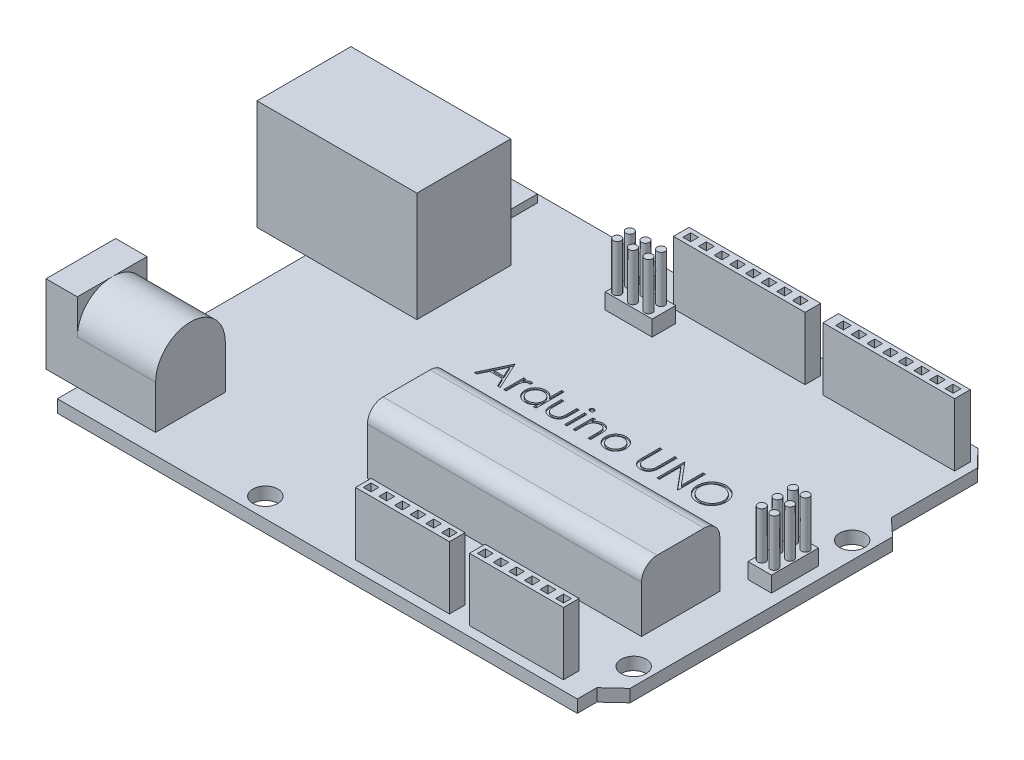
from build123d import *

# Parameters (mm, degrees)
ESQUISSE1_R              = 1.6
PLAQUE_DEPTH             = 1.6
ESQUISSE3_W              = 20.405520634
ESQUISSE3_H              = 12
USB_DEPTH                = 14
ESQUISSE6_W              = 0.314102564
ESQUISSE6_H              = 2.557692307
ARDUINO_UNO_DEPTH        = 0.2
ESQUISSE7_W              = 12
ESQUISSE7_H              = 2
ESQUISSE7_W_2            = 1
ESQUISSE7_H_2            = 1
ESQUISSE7_W_3            = 16.81537658
PIN_1_DEPTH              = 8
USB_VIDE_DEPTH           = 10
ESQUISSE10_W             = 14
ESQUISSE10_H             = 8.9
VOLT_BASE_DEPTH          = 10
VOLT_VIDE_1_DEPTH        = 10
ESQUISSE12_R             = 3.45
VOLT_VIDE_2_DEPTH        = 10
ESQUISSE13_W             = 35
ESQUISSE13_H             = 10
MICROCONTROLLEUR_DEPTH   = 8
MICROCONTROLLEUR_CONGE_R = 2
ESQUISSE14_W             = 3
ESQUISSE14_H             = 6
ESQUISSE14_W_2           = 6
ESQUISSE14_H_2           = 3
PIN_BASE_DEPTH           = 2
ESQUISSE15_R             = 0.5
PIN_PIC_1_DEPTH          = 6
ESQUISSE16_R             = 0.5
PIN_PIC_2_DEPTH          = 6
ESQUISSE17_W             = 6
ESQUISSE17_H             = 6
RESET_BASE_DEPTH         = 1
ESQUISSE18_R             = 1.5
RESET_BOUTON_DEPTH       = 1


with BuildPart() as part:
    # Esquisse1 → PLAQUE (new body)
    with BuildSketch(Plane(origin=(0, 0, 0), x_dir=(1, 0, 0), z_dir=(0, 1, 0))):
        Polygon((32.1, 24.602081959), (29.973807226, 26.823263494), (-34.3, 26.823263494), (-34.3, -26.476736506), (32.1, -26.476736506), (32.1, -23.976736506), (34.3, -21.9371287), (34.3, 11.58568027), (32.1, 13.625288075), align=None)
        with Locations(Location((-10.238193611, -23.976736506, 0), (0, 0, 270))):
            Circle(ESQUISSE1_R, mode=Mode.SUBTRACT)
        with Locations(Location((32.1, -19.276736506, 0), (0, 0, 270))):
            Circle(ESQUISSE1_R, mode=Mode.SUBTRACT)
        with Locations(Location((-9.138193611, 23.823263494, 0), (0, 0, 270))):
            Circle(ESQUISSE1_R, mode=Mode.SUBTRACT)
        with Locations(Location((32.1, 8.623263494, 0), (0, 0, 270))):
            Circle(ESQUISSE1_R, mode=Mode.SUBTRACT)
    extrude(amount=PLAQUE_DEPTH)

    # Esquisse3 → USB (add)
    with BuildSketch(Plane(origin=(0, 1.6, 0), x_dir=(1, 0, 0), z_dir=(0, 1, 0))):
        with Locations((-30.297239683, 11.223263494)):
            Rectangle(ESQUISSE3_W, ESQUISSE3_H)
    extrude(amount=USB_DEPTH)

    # Esquisse6 → Arduino UNO (cut)
    # profile 1 of 11: a face of its own
    with BuildSketch(Plane(origin=(0, 1.6, 0), x_dir=(1, 0, 0), z_dir=(0, 1, 0))):
        Polygon((-8.889191313, 6.549549438), (-7.273806697, 3.049549438), (-7.615253012, 3.049549438), (-8.132680896, 4.171344309), (-9.719319518, 4.171344309), (-10.25147096, 3.049549438), (-10.594319518, 3.049549438), (-8.934063108, 6.549549438), align=None)
        Polygon((-8.915132819, 5.867357931), (-9.548946922, 4.530318668), (-8.29814564, 4.530318668), align=None, mode=Mode.SUBTRACT)
    # profile 2 of 11: a face of its own
    with BuildSketch(Plane(origin=(0, 1.6, 0), x_dir=(1, 0, 0), z_dir=(0, 1, 0))):
        with BuildLine():
            Line((-6.825088749, 5.607241745), (-6.510986185, 5.607241745))
            Line((-6.510986185, 5.607241745), (-6.510986185, 5.230739341))
            add(Edge.make_bspline(
                [(-6.510986185, 5.230739341), (-6.487797426, 5.26579517), (-6.443449105, 5.332839169), (-6.369736176, 5.42150847), (-6.294232844, 5.494923517), (-6.216577657, 5.553427035), (-6.136199557, 5.597240154), (-6.054862605, 5.629333189), (-5.971287135, 5.648310505), (-5.915125211, 5.650844164), (-5.886987787, 5.65211354)],
                knots=[0, 0, 0, 0, 1.2804753, 2.448899062, 3.506932113, 4.484331642, 5.4025378, 6.288909075, 7.142734305, 8, 8, 8, 8], degree=3))
            add(Edge.make_bspline(
                [(-5.886987787, 5.65211354), (-5.865161461, 5.650923014), (-5.820252375, 5.648473428), (-5.752269786, 5.631262603), (-5.682226334, 5.603784581), (-5.637083946, 5.577944358), (-5.613550287, 5.564473316)],
                knots=[0, 0, 0, 0, 0.901110191, 1.854092781, 2.881294221, 4, 4, 4, 4], degree=3))
            Line((-5.613550287, 5.564473316), (-5.786026249, 5.292438059))
            add(Edge.make_bspline(
                [(-5.786026249, 5.292438059), (-5.80113527, 5.299178326), (-5.829815084, 5.311972641), (-5.871769651, 5.327114651), (-5.910450987, 5.336030567), (-5.935094546, 5.337381284), (-5.94658314, 5.338010976)],
                knots=[0, 0, 0, 0, 1.180555205, 2.24091978, 3.179933427, 4, 4, 4, 4], degree=3))
            add(Edge.make_bspline(
                [(-5.94658314, 5.338010976), (-5.971788873, 5.336330939), (-6.023201263, 5.332904149), (-6.098685763, 5.305965342), (-6.171932968, 5.262440102), (-6.23010463, 5.21416899), (-6.275146883, 5.167621192), (-6.307287109, 5.12697279), (-6.336769856, 5.081394158), (-6.364940076, 5.031664474), (-6.39060637, 4.976934628), (-6.41456104, 4.917751415), (-6.436219903, 4.854046286), (-6.448570147, 4.809663766), (-6.454896441, 4.786929245)],
                knots=[0, 0, 0, 0, 1.125678352, 2.296057538, 3.5422874, 4.923748041, 5.663163013, 6.437101912, 7.23742474, 8.08941207, 8.991984279, 9.93940061, 10.944477711, 12, 12, 12, 12], degree=3))
            add(Edge.make_bspline(
                [(-6.454896441, 4.786929245), (-6.459628834, 4.766652072), (-6.470110726, 4.721739673), (-6.480302264, 4.646391148), (-6.490371782, 4.55736749), (-6.4974684, 4.454420897), (-6.504046442, 4.337808453), (-6.507756525, 4.207352507), (-6.510859665, 4.062919156), (-6.510942732, 3.961944803), (-6.510986185, 3.909124758)],
                knots=[0, 0, 0, 0, 0.566838948, 1.255505196, 2.06880316, 3.007127437, 4.065329342, 5.249902469, 6.561414163, 8, 8, 8, 8], degree=3))
            Line((-6.510986185, 3.909124758), (-6.510986185, 3.049549438))
            Line((-6.510986185, 3.049549438), (-6.825088749, 3.049549438))
            Line((-6.825088749, 3.049549438), (-6.825088749, 5.607241745))
        make_face()
    # profile 3 of 11: a face of its own
    with BuildSketch(Plane(origin=(0, 1.6, 0), x_dir=(1, 0, 0), z_dir=(0, 1, 0))):
        with BuildLine():
            Line((-2.69688362, 6.639293027), (-2.69688362, 3.049549438))
            Line((-2.69688362, 3.049549438), (-3.010986185, 3.049549438))
            Line((-3.010986185, 3.049549438), (-3.010986185, 3.49195729))
            add(Edge.make_bspline(
                [(-3.010986185, 3.49195729), (-3.046404975, 3.451917696), (-3.11552519, 3.373779925), (-3.230966308, 3.271697753), (-3.353334486, 3.187319431), (-3.482035807, 3.119169515), (-3.616954051, 3.067977459), (-3.757790138, 3.0315913), (-3.904601519, 3.008197465), (-4.004853874, 3.005861443), (-4.055657659, 3.004677643)],
                knots=[0, 0, 0, 0, 1.074387032, 2.096679803, 3.090159297, 4.057316773, 5.018401886, 5.985159533, 6.978961417, 8, 8, 8, 8], degree=3))
            add(Edge.make_bspline(
                [(-4.055657659, 3.004677643), (-4.100825613, 3.005904015), (-4.189898818, 3.008322475), (-4.320927895, 3.027084779), (-4.447020144, 3.057215401), (-4.568294717, 3.09911629), (-4.683966862, 3.154697112), (-4.795026959, 3.22123836), (-4.900899651, 3.30047919), (-4.99997119, 3.391067218), (-5.09120319, 3.489462205), (-5.171264463, 3.594407752), (-5.238017543, 3.705450056), (-5.293837624, 3.82118321), (-5.336833968, 3.94249813), (-5.366807602, 4.068975298), (-5.385548049, 4.200465171), (-5.38796551, 4.290004694), (-5.389191313, 4.335406809)],
                knots=[0, 0, 0, 0, 1.033919861, 2.038935746, 3.024066025, 3.998881131, 4.97069526, 5.957263378, 6.95902576, 7.993208707, 9.027059324, 10.027763471, 11.009749337, 11.988697705, 12.965288445, 13.950418724, 14.960734635, 16, 16, 16, 16], degree=3))
            add(Edge.make_bspline(
                [(-5.389191313, 4.335406809), (-5.387938341, 4.379870513), (-5.385461285, 4.467772856), (-5.367008065, 4.597051554), (-5.335977056, 4.721569815), (-5.292429208, 4.840926758), (-5.236587253, 4.955266808), (-5.168659166, 5.064670833), (-5.088640042, 5.169440231), (-4.996387635, 5.267111458), (-4.896452865, 5.357332072), (-4.789544134, 5.435741117), (-4.678320852, 5.503457966), (-4.561057842, 5.557111443), (-4.439490737, 5.600520547), (-4.312537291, 5.630553515), (-4.180725713, 5.648250836), (-4.09123522, 5.650813601), (-4.045841954, 5.65211354)],
                knots=[0, 0, 0, 0, 1.020392517, 2.01726096, 2.990465484, 3.961182959, 4.928053699, 5.906110375, 6.912531644, 7.948652711, 8.985773172, 9.998621852, 10.987621588, 11.969261332, 12.953316658, 13.946091881, 14.958173133, 16, 16, 16, 16], degree=3))
            add(Edge.make_bspline(
                [(-4.045841954, 5.65211354), (-3.993625146, 5.650546444), (-3.891129355, 5.647470409), (-3.741230834, 5.621764042), (-3.599443223, 5.578601164), (-3.464950236, 5.519509883), (-3.338553676, 5.442709131), (-3.219327035, 5.349957684), (-3.109343712, 5.238630537), (-3.04427189, 5.155018964), (-3.010986185, 5.112249758)],
                knots=[0, 0, 0, 0, 1.031072012, 2.023879775, 2.993683497, 3.952812103, 4.918022106, 5.908088563, 6.929940113, 8, 8, 8, 8], degree=3))
            Line((-3.010986185, 5.112249758), (-3.010986185, 6.639293027))
            Line((-3.010986185, 6.639293027), (-2.69688362, 6.639293027))
        make_face()
        with BuildLine():
            add(Edge.make_bspline(
                [(-4.041635223, 5.338010976), (-4.087549561, 5.336377338), (-4.178177161, 5.333152797), (-4.311221163, 5.307979302), (-4.438534577, 5.266094708), (-4.559480651, 5.208812807), (-4.672148868, 5.13678407), (-4.772842539, 5.049662687), (-4.86238524, 4.949825673), (-4.937693504, 4.837723562), (-4.999084001, 4.717545471), (-5.042251033, 4.591921033), (-5.070720281, 4.463116055), (-5.073628801, 4.37575337), (-5.075088749, 4.3319012)],
                knots=[0, 0, 0, 0, 1.031046209, 2.035121221, 3.029706178, 4.034933723, 5.034054252, 6.02443088, 7.017295772, 8.038157696, 9.050218397, 10.03989886, 11.016116709, 12, 12, 12, 12], degree=3))
            add(Edge.make_bspline(
                [(-5.075088749, 4.3319012), (-5.073223855, 4.288311093), (-5.069501379, 4.201301737), (-5.042750684, 4.072321161), (-4.997870811, 3.946667119), (-4.936628748, 3.825406125), (-4.859942123, 3.712822025), (-4.771053471, 3.611081902), (-4.669103189, 3.523592314), (-4.556175682, 3.45035474), (-4.435567712, 3.391192219), (-4.30873378, 3.35002658), (-4.178058142, 3.323448799), (-4.089205808, 3.320344322), (-4.04443971, 3.318780207)],
                knots=[0, 0, 0, 0, 0.979072187, 1.954306742, 2.945804271, 3.96968567, 4.997920485, 5.998718438, 6.996577872, 8.005894225, 9.015743152, 10.005417472, 10.995077863, 12, 12, 12, 12], degree=3))
            add(Edge.make_bspline(
                [(-4.04443971, 3.318780207), (-3.998993207, 3.320440171), (-3.908604621, 3.323741674), (-3.775165913, 3.34902294), (-3.64567095, 3.390791738), (-3.521883722, 3.448690865), (-3.406567591, 3.520448221), (-3.303069713, 3.604455312), (-3.215553745, 3.702158496), (-3.141361135, 3.809534949), (-3.083185718, 3.927246945), (-3.040809659, 4.052581136), (-3.015755753, 4.185541884), (-3.012598024, 4.276405811), (-3.010986185, 4.322786617)],
                knots=[0, 0, 0, 0, 1.01762866, 2.023962475, 3.030623092, 4.058876274, 5.077231937, 6.066672613, 7.034107872, 8.005628644, 8.981990164, 9.965428785, 10.961468474, 12, 12, 12, 12], degree=3))
            add(Edge.make_bspline(
                [(-3.010986185, 4.322786617), (-3.011945841, 4.358124448), (-3.013834748, 4.427680481), (-3.028265318, 4.529807999), (-3.051220244, 4.627541725), (-3.083566414, 4.720984414), (-3.126057699, 4.809619429), (-3.177305465, 4.894083189), (-3.238210914, 4.973936401), (-3.30779361, 5.048079472), (-3.383958813, 5.115705934), (-3.464553354, 5.176070175), (-3.550532101, 5.225658947), (-3.640449138, 5.266700219), (-3.734460472, 5.299359369), (-3.833331092, 5.321147062), (-3.936010079, 5.336107384), (-4.006056134, 5.337369764), (-4.041635223, 5.338010976)],
                knots=[0, 0, 0, 0, 1.050140795, 2.067009409, 3.05949893, 4.030605086, 5.00011959, 5.97591094, 6.962425594, 7.979863591, 8.993523472, 9.986985069, 10.967611495, 11.937549037, 12.921786183, 13.919465291, 14.943216303, 16, 16, 16, 16], degree=3))
        make_face(mode=Mode.SUBTRACT)
    # profile 4 of 11: a face of its own
    with BuildSketch(Plane(origin=(0, 1.6, 0), x_dir=(1, 0, 0), z_dir=(0, 1, 0))):
        with BuildLine():
            Line((-2.023806697, 5.607241745), (-1.709704133, 5.607241745))
            Line((-1.709704133, 5.607241745), (-1.709704133, 4.420943668))
            add(Edge.make_bspline(
                [(-1.709704133, 4.420943668), (-1.709562228, 4.386120919), (-1.709290771, 4.319506631), (-1.70744983, 4.223651444), (-1.703119736, 4.136234732), (-1.697705912, 4.057205995), (-1.690743776, 3.986578603), (-1.682460415, 3.924599246), (-1.673201994, 3.870565062), (-1.66413928, 3.838021707), (-1.659924486, 3.822886777)],
                knots=[0, 0, 0, 0, 1.388932606, 2.656963016, 3.823490214, 4.879454478, 5.816252168, 6.653371382, 7.373723809, 8, 8, 8, 8], degree=3))
            add(Edge.make_bspline(
                [(-1.659924486, 3.822886777), (-1.653163031, 3.803863906), (-1.63978069, 3.766213645), (-1.615507206, 3.71182464), (-1.58547887, 3.661449358), (-1.552619042, 3.613145285), (-1.514719634, 3.568343298), (-1.472260163, 3.527119054), (-1.426661926, 3.487914963), (-1.358906903, 3.441530171), (-1.266247637, 3.391814841), (-1.144594881, 3.348919023), (-1.012690655, 3.323283203), (-0.921525936, 3.320308948), (-0.874668076, 3.318780207)],
                knots=[0, 0, 0, 0, 0.725840625, 1.436591201, 2.137033971, 2.831655856, 3.53531722, 4.242432219, 4.957935707, 5.694543706, 7.190802206, 8.724350549, 10.316345118, 12, 12, 12, 12], degree=3))
            add(Edge.make_bspline(
                [(-0.874668076, 3.318780207), (-0.827814568, 3.320341455), (-0.7371617, 3.323362183), (-0.60670673, 3.348145721), (-0.487455316, 3.38955141), (-0.380604365, 3.447358822), (-0.286638524, 3.518100885), (-0.208334106, 3.601109694), (-0.143726851, 3.69375908), (-0.11551743, 3.762883359), (-0.101330736, 3.797646393)],
                knots=[0, 0, 0, 0, 1.157059328, 2.238695713, 3.266970494, 4.264342957, 5.228770407, 6.160125903, 7.074715775, 8, 8, 8, 8], degree=3))
            add(Edge.make_bspline(
                [(-0.101330736, 3.797646393), (-0.097136506, 3.811612691), (-0.087864087, 3.842488767), (-0.077901736, 3.894868515), (-0.068927274, 3.95733312), (-0.061264098, 4.030291328), (-0.055798936, 4.113552481), (-0.052852909, 4.207090557), (-0.049524634, 4.310611917), (-0.049474118, 4.383079677), (-0.049447723, 4.420943668)],
                knots=[0, 0, 0, 0, 0.557542046, 1.232589297, 2.036731608, 2.971723315, 4.038036528, 5.22795436, 6.551621927, 8, 8, 8, 8], degree=3))
            Line((-0.049447723, 4.420943668), (-0.049447723, 5.607241745))
            Line((-0.049447723, 5.607241745), (0.264654841, 5.607241745))
            Line((0.264654841, 5.607241745), (0.264654841, 4.362049438))
            add(Edge.make_bspline(
                [(0.264654841, 4.362049438), (0.264213146, 4.319742266), (0.263356198, 4.237660566), (0.257848854, 4.118376455), (0.248399242, 4.00721421), (0.234056557, 3.90411499), (0.217190882, 3.809157508), (0.195434609, 3.722220062), (0.169456371, 3.643570508), (0.140150856, 3.571828731), (0.105528989, 3.506781837), (0.068701968, 3.445046021), (0.026177197, 3.388153085), (-0.018593038, 3.333270948), (-0.068394694, 3.283129421), (-0.122294553, 3.236577945), (-0.179533972, 3.192904913), (-0.24138317, 3.153813634), (-0.306939233, 3.118596989), (-0.37628309, 3.08738091), (-0.450264089, 3.062678333), (-0.527927725, 3.041367668), (-0.609654505, 3.024653198), (-0.695365638, 3.012866632), (-0.785032254, 3.005641301), (-0.846141714, 3.005004256), (-0.877472563, 3.004677643)],
                knots=[0, 0, 0, 0, 1.493040784, 2.896703357, 4.213163133, 5.428574705, 6.569057535, 7.615249723, 8.588095153, 9.490268104, 10.346124644, 11.18633936, 12.024365274, 12.850166724, 13.684164916, 14.514361689, 15.362232829, 16.222528818, 17.093394965, 17.986930858, 18.902426812, 19.842810585, 20.827885679, 21.843828298, 22.894529745, 24, 24, 24, 24], degree=3))
            add(Edge.make_bspline(
                [(-0.877472563, 3.004677643), (-0.908569077, 3.00501735), (-0.969676622, 3.005684906), (-1.059347866, 3.012826714), (-1.145296473, 3.024634884), (-1.227216871, 3.041490102), (-1.305191268, 3.062529172), (-1.379535508, 3.087532707), (-1.449379071, 3.118613189), (-1.515561075, 3.153590746), (-1.577563463, 3.193156022), (-1.635672042, 3.236524061), (-1.689808894, 3.283630125), (-1.739985962, 3.334277482), (-1.785498939, 3.389094418), (-1.82691498, 3.447639978), (-1.864871685, 3.509334067), (-1.899224476, 3.575397229), (-1.928736231, 3.647969239), (-1.954791477, 3.728266336), (-1.976102116, 3.817168853), (-1.993444584, 3.914600782), (-2.007396025, 4.020095823), (-2.017082167, 4.134264238), (-2.022497998, 4.256827931), (-2.023361059, 4.341477821), (-2.023806697, 4.385186457)],
                knots=[0, 0, 0, 0, 1.083640291, 2.129454052, 3.13281866, 4.105697902, 5.042300162, 5.946461698, 6.836384745, 7.703652036, 8.553297018, 9.397182691, 10.228592656, 11.052265423, 11.879314572, 12.708807002, 13.549817954, 14.402308542, 15.300838682, 16.27712199, 17.341985831, 18.484375296, 19.725102775, 21.0496083, 22.476576903, 24, 24, 24, 24], degree=3))
            Line((-2.023806697, 4.385186457), (-2.023806697, 5.607241745))
        make_face()
    # profile 5 of 11: a face of its own
    with BuildSketch(Plane(origin=(0, 1.6, 0), x_dir=(1, 0, 0), z_dir=(0, 1, 0))):
        with BuildLine():
            add(Edge.make_bspline(
                [(1.093380803, 6.684164822), (1.112872118, 6.68326067), (1.151039858, 6.681490166), (1.206233126, 6.666328689), (1.256490138, 6.640629003), (1.301067871, 6.606149322), (1.339319758, 6.565599879), (1.366100468, 6.518338911), (1.383312864, 6.467280272), (1.385391419, 6.431665183), (1.386449713, 6.413531809)],
                knots=[0, 0, 0, 0, 1.055194115, 2.066272739, 3.074728998, 4.095836921, 5.109056067, 6.073838105, 7.019297344, 8, 8, 8, 8], degree=3))
            add(Edge.make_bspline(
                [(1.386449713, 6.413531809), (1.385367553, 6.395869156), (1.383228251, 6.360952181), (1.366113763, 6.310778709), (1.339091525, 6.264174426), (1.301092399, 6.223703715), (1.256483638, 6.189243095), (1.206234853, 6.163538357), (1.151039404, 6.148378219), (1.112871965, 6.14660753), (1.093380803, 6.145703284)],
                knots=[0, 0, 0, 0, 0.96129708, 1.900370562, 2.859976407, 3.87933698, 4.906634145, 5.921202961, 6.938410037, 8, 8, 8, 8], degree=3))
            add(Edge.make_bspline(
                [(1.093380803, 6.145703284), (1.074112527, 6.146573004), (1.036609347, 6.148265801), (0.982242505, 6.163835819), (0.932414016, 6.189251892), (0.887749343, 6.223478077), (0.85051915, 6.264422974), (0.823420824, 6.310750268), (0.806345862, 6.360959422), (0.804201234, 6.395871589), (0.80311638, 6.413531809)],
                knots=[0, 0, 0, 0, 1.054934014, 2.053291228, 3.073705704, 4.106921865, 5.123545215, 6.088680038, 7.033164197, 8, 8, 8, 8], degree=3))
            add(Edge.make_bspline(
                [(0.80311638, 6.413531809), (0.804177466, 6.431662659), (0.806261507, 6.467272792), (0.823433623, 6.518367825), (0.850293431, 6.565349326), (0.887773995, 6.606374826), (0.932407455, 6.640620261), (0.9822442, 6.666031242), (1.036608899, 6.681602581), (1.074112375, 6.683295196), (1.093380803, 6.684164822)],
                knots=[0, 0, 0, 0, 0.98631895, 1.937192651, 2.907499808, 3.917963147, 4.944918757, 5.95915025, 6.951458133, 8, 8, 8, 8], degree=3))
        make_face()
    # profile 6 of 11: a face of its own
    with BuildSketch(Plane(origin=(0, 1.6, 0), x_dir=(1, 0, 0), z_dir=(0, 1, 0))):
        with Locations((1.094783046, 4.328395592)):
            Rectangle(ESQUISSE6_W, ESQUISSE6_H)
    # profile 7 of 11: a face of its own
    with BuildSketch(Plane(origin=(0, 1.6, 0), x_dir=(1, 0, 0), z_dir=(0, 1, 0))):
        with BuildLine():
            Line((2.014654841, 5.607241745), (2.328757405, 5.607241745))
            Line((2.328757405, 5.607241745), (2.328757405, 5.145903604))
            add(Edge.make_bspline(
                [(2.328757405, 5.145903604), (2.36229504, 5.187746327), (2.427375991, 5.268943591), (2.535760325, 5.375664165), (2.650304225, 5.46360939), (2.770306228, 5.533713184), (2.895929239, 5.58655981), (3.026407508, 5.624725741), (3.162522215, 5.64761057), (3.255086651, 5.6506008), (3.301914456, 5.65211354)],
                knots=[0, 0, 0, 0, 1.12780773, 2.188550248, 3.19190651, 4.159438251, 5.104880172, 6.052711206, 7.014878035, 8, 8, 8, 8], degree=3))
            add(Edge.make_bspline(
                [(3.301914456, 5.65211354), (3.349245091, 5.650368345), (3.441882558, 5.646952576), (3.57676062, 5.619935885), (3.702734013, 5.57379063), (3.819353569, 5.51057856), (3.924480783, 5.431972086), (4.016805634, 5.340394304), (4.093168881, 5.235058221), (4.144366244, 5.137335065), (4.178091892, 5.050646271), (4.19932423, 4.976399521), (4.217355211, 4.893681369), (4.232986959, 4.80274178), (4.243564071, 4.70294359), (4.251906362, 4.594695898), (4.257885057, 4.478033768), (4.258122264, 4.39734714), (4.258244585, 4.355739341)],
                knots=[0, 0, 0, 0, 1.235846778, 2.418850247, 3.575807741, 4.728682307, 5.871620074, 6.994088408, 8.11269785, 9.256955736, 9.865816715, 10.540099792, 11.271859618, 12.076849838, 12.949306005, 13.892391288, 14.913166135, 16, 16, 16, 16], degree=3))
            Line((4.258244585, 4.355739341), (4.258244585, 3.049549438))
            Line((4.258244585, 3.049549438), (3.944142021, 3.049549438))
            Line((3.944142021, 3.049549438), (3.944142021, 4.252674438))
            add(Edge.make_bspline(
                [(3.944142021, 4.252674438), (3.943948813, 4.287496883), (3.943579238, 4.354106293), (3.942413592, 4.449475317), (3.939603785, 4.535961895), (3.935655472, 4.613359262), (3.929876442, 4.681593099), (3.92385381, 4.740802376), (3.916488834, 4.790911918), (3.90992592, 4.821077), (3.906982565, 4.834605527)],
                knots=[0, 0, 0, 0, 1.430800155, 2.736877192, 3.918605307, 4.986035426, 5.920637409, 6.731861385, 7.431261377, 8, 8, 8, 8], degree=3))
            add(Edge.make_bspline(
                [(3.906982565, 4.834605527), (3.896357034, 4.874316712), (3.875906173, 4.950748457), (3.82537219, 5.05442281), (3.761558009, 5.142620997), (3.68366016, 5.214797719), (3.592431084, 5.270968556), (3.488123942, 5.30994251), (3.371745301, 5.33431878), (3.289890918, 5.336745912), (3.247226956, 5.338010976)],
                knots=[0, 0, 0, 0, 1.084156227, 2.086665306, 3.027808233, 3.945421172, 4.874247719, 5.839848303, 6.874090471, 8, 8, 8, 8], degree=3))
            add(Edge.make_bspline(
                [(3.247226956, 5.338010976), (3.221959273, 5.337534971), (3.17195518, 5.33659297), (3.097805208, 5.327141672), (3.025881035, 5.311683217), (2.955460826, 5.290814579), (2.887953032, 5.26215231), (2.821188741, 5.22962294), (2.757681977, 5.189074728), (2.69607858, 5.143884106), (2.638765772, 5.093804899), (2.585437434, 5.040960389), (2.537899413, 4.984684785), (2.494830738, 4.925884838), (2.457652475, 4.863753), (2.425199387, 4.798888693), (2.397663692, 4.731206545), (2.383980999, 4.684231483), (2.377134809, 4.660727322)],
                knots=[0, 0, 0, 0, 1.023777757, 2.026029729, 3.023749952, 4.003683103, 4.997618607, 5.993177895, 7.010360494, 8.046726602, 9.087585522, 10.09234134, 11.086953743, 12.070360549, 13.043493632, 14.017870808, 15.008233677, 16, 16, 16, 16], degree=3))
            add(Edge.make_bspline(
                [(2.377134809, 4.660727322), (2.37319516, 4.643472119), (2.364618752, 4.605908445), (2.355355572, 4.544264025), (2.346947996, 4.47295405), (2.339911038, 4.392061733), (2.335605621, 4.301303858), (2.330911224, 4.20106802), (2.329202163, 4.090954532), (2.328909809, 4.014292839), (2.328757405, 3.974329085)],
                knots=[0, 0, 0, 0, 0.615963638, 1.340920617, 2.168419149, 3.115676021, 4.16674242, 5.331190069, 6.6087489, 8, 8, 8, 8], degree=3))
            Line((2.328757405, 3.974329085), (2.328757405, 3.049549438))
            Line((2.328757405, 3.049549438), (2.014654841, 3.049549438))
            Line((2.014654841, 3.049549438), (2.014654841, 5.607241745))
        make_face()
    # profile 8 of 11: a face of its own
    with BuildSketch(Plane(origin=(0, 1.6, 0), x_dir=(1, 0, 0), z_dir=(0, 1, 0))):
        with BuildLine():
            add(Edge.make_bspline(
                [(6.211569905, 5.65211354), (6.259561178, 5.651091649), (6.353660336, 5.64908797), (6.491468221, 5.627673005), (6.623013357, 5.59492564), (6.74879955, 5.549654078), (6.867215845, 5.488972128), (6.979987089, 5.416562836), (7.086804098, 5.330780243), (7.150827127, 5.264422175), (7.183324713, 5.230739341)],
                knots=[0, 0, 0, 0, 1.054011418, 2.066658804, 3.057071809, 4.030435133, 4.997543892, 5.974964718, 6.972108034, 8, 8, 8, 8], degree=3))
            add(Edge.make_bspline(
                [(7.183324713, 5.230739341), (7.211306667, 5.198525356), (7.266729047, 5.134720813), (7.337794766, 5.0312652), (7.399016326, 4.9241251), (7.448079287, 4.811877773), (7.486764311, 4.695503102), (7.514230007, 4.574601091), (7.530566942, 4.449438744), (7.532769909, 4.364434906), (7.53388561, 4.321384374)],
                knots=[0, 0, 0, 0, 1.025258237, 2.030674902, 3.01204498, 3.988269485, 4.97094183, 5.956517959, 6.965070386, 8, 8, 8, 8], degree=3))
            add(Edge.make_bspline(
                [(7.53388561, 4.321384374), (7.532904273, 4.278084316), (7.530965105, 4.192521383), (7.512621488, 4.066502017), (7.484090402, 3.944307194), (7.443258564, 3.8264485), (7.390900455, 3.712565673), (7.327009767, 3.603156124), (7.25113815, 3.49800399), (7.165134154, 3.398002152), (7.070082277, 3.305835937), (6.966966129, 3.225507668), (6.857812095, 3.156686143), (6.741168742, 3.101249728), (6.618101255, 3.057540027), (6.488344187, 3.026840011), (6.352099117, 3.008278327), (6.259071895, 3.005894754), (6.211569905, 3.004677643)],
                knots=[0, 0, 0, 0, 0.998656419, 1.973391657, 2.932242238, 3.890759089, 4.846373663, 5.82037756, 6.809684879, 7.83454468, 8.860553229, 9.859544525, 10.845671541, 11.83227036, 12.833544569, 13.85385346, 14.904124723, 16, 16, 16, 16], degree=3))
            add(Edge.make_bspline(
                [(6.211569905, 3.004677643), (6.163835186, 3.005898839), (6.070344326, 3.008290613), (5.933618344, 3.026767896), (5.803628725, 3.057525879), (5.680400127, 3.101393371), (5.56325528, 3.156687915), (5.453468783, 3.225299605), (5.350268867, 3.30585976), (5.255196883, 3.397995697), (5.169198277, 3.498005653), (5.093325269, 3.603155692), (5.029434943, 3.712565785), (4.977076739, 3.82644847), (4.936244926, 3.944307202), (4.907713833, 4.066502015), (4.889370219, 4.192521383), (4.88743105, 4.278084316), (4.886449713, 4.321384374)],
                knots=[0, 0, 0, 0, 1.099876186, 2.154163076, 3.173186993, 4.173200201, 5.163417411, 6.152872554, 7.150605724, 8.17532212, 9.198891216, 10.186952605, 11.159729845, 12.11414092, 13.071450619, 14.029093627, 15.002601286, 16, 16, 16, 16], degree=3))
            add(Edge.make_bspline(
                [(4.886449713, 4.321384374), (4.887573023, 4.364200919), (4.889796985, 4.448970322), (4.906117494, 4.573897382), (4.93347605, 4.694594772), (4.972207447, 4.810520248), (5.021722638, 4.922275684), (5.082083926, 5.029680515), (5.153874558, 5.132668315), (5.20907651, 5.196390395), (5.23701061, 5.228635976)],
                knots=[0, 0, 0, 0, 1.031353054, 2.041901799, 3.029428768, 4.008703097, 4.981709435, 5.96992636, 6.972712378, 8, 8, 8, 8], degree=3))
            add(Edge.make_bspline(
                [(5.23701061, 5.228635976), (5.269459201, 5.262610915), (5.333275065, 5.329428612), (5.440623793, 5.414961136), (5.553117614, 5.488877209), (5.67284254, 5.548353425), (5.798525398, 5.595191943), (5.930744641, 5.627757458), (6.069020156, 5.649010813), (6.163579777, 5.651068991), (6.211569905, 5.65211354)],
                knots=[0, 0, 0, 0, 1.027980169, 2.021703884, 2.998553061, 3.971491411, 4.943284454, 5.930300938, 6.949603206, 8, 8, 8, 8], degree=3))
        make_face()
        with BuildLine():
            add(Edge.make_bspline(
                [(6.210167662, 5.338010976), (6.17623005, 5.337046384), (6.109230922, 5.335142102), (6.010611337, 5.320658197), (5.915671183, 5.297710693), (5.824230339, 5.265106637), (5.736597166, 5.223007738), (5.652687764, 5.171299378), (5.572255324, 5.110666421), (5.496873261, 5.04120375), (5.427690949, 4.965324755), (5.367212972, 4.884476396), (5.315787866, 4.79997005), (5.272947707, 4.711717839), (5.241040519, 4.618825425), (5.217867496, 4.522344794), (5.203397256, 4.422079377), (5.201510877, 4.353918359), (5.200552277, 4.319281008)],
                knots=[0, 0, 0, 0, 1.021534396, 2.016698045, 2.994645724, 3.958388632, 4.93408049, 5.916473867, 6.921342795, 7.962252576, 8.998418191, 10.008913653, 10.997312074, 11.973003931, 12.956656626, 13.948281152, 14.957379055, 16, 16, 16, 16], degree=3))
            add(Edge.make_bspline(
                [(5.200552277, 4.319281008), (5.202159101, 4.274528981), (5.205348345, 4.185704575), (5.231283581, 4.054893453), (5.274669861, 3.929311601), (5.333257141, 3.809695215), (5.40666336, 3.699022937), (5.493150426, 3.600351452), (5.591790127, 3.515165641), (5.701406627, 3.444484795), (5.819760945, 3.38832504), (5.945017266, 3.348526064), (6.07565796, 3.322654371), (6.164938691, 3.320082897), (6.210167662, 3.318780207)],
                knots=[0, 0, 0, 0, 1.016792936, 2.018143844, 3.017858371, 4.030088057, 5.03801393, 6.028138512, 7.003788237, 7.991172063, 8.984598303, 9.972568034, 10.972917682, 12, 12, 12, 12], degree=3))
            add(Edge.make_bspline(
                [(6.210167662, 3.318780207), (6.255394031, 3.320090487), (6.344669626, 3.322676944), (6.475128803, 3.348395764), (6.600042775, 3.388499424), (6.718274163, 3.444421634), (6.827840766, 3.515434049), (6.927189887, 3.599870426), (7.012938499, 3.699284277), (7.086272104, 3.809841806), (7.145818846, 3.929126158), (7.189002048, 4.054916631), (7.214999634, 4.185698673), (7.218180463, 4.274527003), (7.219783046, 4.319281008)],
                knots=[0, 0, 0, 0, 1.02726834, 2.027799167, 3.010890988, 4.004497153, 4.992059811, 5.971914811, 6.958719428, 7.966827853, 8.981595046, 9.981490638, 10.983022906, 12, 12, 12, 12], degree=3))
            add(Edge.make_bspline(
                [(7.219783046, 4.319281008), (7.218824776, 4.353918566), (7.216939047, 4.422079992), (7.202464083, 4.522342445), (7.179308543, 4.618834042), (7.147336926, 4.711686045), (7.104682912, 4.800198549), (7.052266119, 4.884228276), (6.992035093, 4.965604822), (6.922017973, 5.040958463), (6.846714595, 5.1106935), (6.766249556, 5.171322889), (6.682464578, 5.222780485), (6.595085995, 5.265466725), (6.503633428, 5.297414066), (6.408826298, 5.320790697), (6.310627488, 5.335080894), (6.243868445, 5.337028035), (6.210167662, 5.338010976)],
                knots=[0, 0, 0, 0, 1.042956736, 2.052379634, 3.044323526, 4.02829302, 5.004299113, 5.996692471, 7.007513377, 8.048758398, 9.090003419, 10.095195979, 11.07790575, 12.047570684, 13.018257071, 13.989683339, 14.985167495, 16, 16, 16, 16], degree=3))
        make_face(mode=Mode.SUBTRACT)
    # profile 9 of 11: a face of its own
    with BuildSketch(Plane(origin=(0, 1.6, 0), x_dir=(1, 0, 0), z_dir=(0, 1, 0))):
        with BuildLine():
            Line((9.597988174, 6.549549438), (9.912090738, 6.549549438))
            Line((9.912090738, 6.549549438), (9.912090738, 4.452494149))
            add(Edge.make_bspline(
                [(9.912090738, 4.452494149), (9.912043995, 4.422813413), (9.91195529, 4.366489102), (9.912547804, 4.286320802), (9.914207172, 4.215048343), (9.915253332, 4.152396995), (9.917580665, 4.098654248), (9.919478712, 4.053528937), (9.921919269, 4.017234735), (9.924852386, 3.996053809), (9.926113174, 3.986949277)],
                knots=[0, 0, 0, 0, 1.528628734, 2.90083645, 4.128790002, 5.200304208, 6.127813768, 6.898992206, 7.526736466, 8, 8, 8, 8], degree=3))
            add(Edge.make_bspline(
                [(9.926113174, 3.986949277), (9.931290633, 3.954102514), (9.94135382, 3.890259785), (9.967000197, 3.799351503), (10.002817698, 3.717420045), (10.045260741, 3.641908754), (10.101193352, 3.574919394), (10.168196888, 3.513207741), (10.249374656, 3.459235936), (10.339635262, 3.409885124), (10.436920499, 3.370220042), (10.536331766, 3.340226678), (10.636374745, 3.321947778), (10.70335091, 3.319831239), (10.736609969, 3.318780207)],
                knots=[0, 0, 0, 0, 1.035780045, 2.013197591, 2.933192213, 3.817615948, 4.702609284, 5.640816605, 6.646850145, 7.73207398, 8.84249596, 9.914020372, 10.964143139, 12, 12, 12, 12], degree=3))
            add(Edge.make_bspline(
                [(10.736609969, 3.318780207), (10.76516371, 3.319854057), (10.822106272, 3.321995555), (10.906712702, 3.335256986), (10.989112811, 3.359157552), (11.069713491, 3.389997311), (11.145264475, 3.430744902), (11.215807917, 3.477815741), (11.278771851, 3.533026617), (11.336229849, 3.594126962), (11.386264785, 3.663066762), (11.429635927, 3.7383449), (11.465161856, 3.821094247), (11.482705381, 3.879248669), (11.491718142, 3.909124758)],
                knots=[0, 0, 0, 0, 0.994687771, 1.983630487, 2.973142513, 3.978332533, 4.983357753, 5.956394766, 6.925816176, 7.893390482, 8.871859704, 9.88551698, 10.913711441, 12, 12, 12, 12], degree=3))
            add(Edge.make_bspline(
                [(11.491718142, 3.909124758), (11.494718268, 3.921473332), (11.501403756, 3.948990933), (11.507650801, 3.995512223), (11.514157326, 4.050401587), (11.518671896, 4.1140534), (11.523073117, 4.186254372), (11.525706189, 4.26738063), (11.526923222, 4.357137591), (11.527285903, 4.419774753), (11.527475354, 4.452494149)],
                knots=[0, 0, 0, 0, 0.558680831, 1.244966039, 2.062412453, 2.990489873, 4.051219941, 5.244515665, 6.560634259, 8, 8, 8, 8], degree=3))
            Line((11.527475354, 4.452494149), (11.527475354, 6.549549438))
            Line((11.527475354, 6.549549438), (11.841577918, 6.549549438))
            Line((11.841577918, 6.549549438), (11.841577918, 4.435667226))
            add(Edge.make_bspline(
                [(11.841577918, 4.435667226), (11.841323798, 4.397568847), (11.840827866, 4.323217544), (11.83652729, 4.214266185), (11.82967029, 4.110913204), (11.819982202, 4.013144707), (11.807145199, 3.921310548), (11.792869978, 3.83460578), (11.774690445, 3.753652787), (11.753457044, 3.67782037), (11.729183496, 3.605634856), (11.697742348, 3.537126242), (11.662317848, 3.470211842), (11.620303195, 3.405903733), (11.573091812, 3.34391718), (11.519640131, 3.284628105), (11.46171597, 3.227089059), (11.398356411, 3.172775992), (11.330605886, 3.122967316), (11.258665928, 3.079169545), (11.183089158, 3.042145927), (11.104072032, 3.011670003), (11.021580829, 2.988755403), (10.935613469, 2.971680248), (10.845974276, 2.96197795), (10.78500962, 2.96053602), (10.754138014, 2.959805848)],
                knots=[0, 0, 0, 0, 1.316592851, 2.569410997, 3.76748051, 4.895814652, 5.963796859, 6.97159953, 7.931736103, 8.829262218, 9.692595152, 10.560224239, 11.431080259, 12.30701507, 13.211635791, 14.121146779, 15.063487852, 16.031507147, 17.00238618, 17.966455255, 18.938106653, 19.907068911, 20.888905087, 21.893141452, 22.933117798, 24, 24, 24, 24], degree=3))
            add(Edge.make_bspline(
                [(10.754138014, 2.959805848), (10.720468912, 2.960590613), (10.654410253, 2.96213032), (10.557072185, 2.97095307), (10.463757989, 2.987571464), (10.373482112, 3.008731408), (10.287473615, 3.037915145), (10.204580171, 3.07201327), (10.126221489, 3.11389053), (10.051126361, 3.160483923), (9.981301605, 3.212908562), (9.917204202, 3.270048736), (9.858728331, 3.330989113), (9.806859635, 3.396389479), (9.76073875, 3.465741186), (9.721008537, 3.539240425), (9.686895292, 3.616858742), (9.669288725, 3.670811942), (9.660388014, 3.698087098)],
                knots=[0, 0, 0, 0, 1.13879206, 2.234305948, 3.301075583, 4.341971843, 5.366689343, 6.369221514, 7.369726634, 8.367512178, 9.355451585, 10.318319045, 11.268648973, 12.207971039, 13.137398894, 14.081662264, 15.030215811, 16, 16, 16, 16], degree=3))
            add(Edge.make_bspline(
                [(9.660388014, 3.698087098), (9.655210856, 3.716719672), (9.643981485, 3.757134141), (9.631956187, 3.82402063), (9.621847105, 3.901035547), (9.612341547, 3.988184166), (9.606732589, 4.085534032), (9.60181515, 4.193042948), (9.597953532, 4.31084091), (9.597976304, 4.392895426), (9.597988174, 4.435667226)],
                knots=[0, 0, 0, 0, 0.625038921, 1.35572334, 2.194682327, 3.136881307, 4.189498639, 5.346923369, 6.617055217, 8, 8, 8, 8], degree=3))
            Line((9.597988174, 4.435667226), (9.597988174, 6.549549438))
        make_face()
    # profile 10 of 11: a face of its own
    with BuildSketch(Plane(origin=(0, 1.6, 0), x_dir=(1, 0, 0), z_dir=(0, 1, 0))):
        Polygon((12.739013815, 3.049549438), (12.739013815, 6.549549438), (12.804919264, 6.549549438), (15.117218944, 3.794841906), (15.117218944, 6.549549438), (15.431321508, 6.549549438), (15.431321508, 3.049549438), (15.359807085, 3.049549438), (13.05311638, 5.797946874), (13.05311638, 3.049549438), align=None)
    # profile 11 of 11: a face of its own
    with BuildSketch(Plane(origin=(0, 1.6, 0), x_dir=(1, 0, 0), z_dir=(0, 1, 0))):
        with BuildLine():
            add(Edge.make_bspline(
                [(17.966577918, 6.639293027), (18.031386024, 6.637651548), (18.158674491, 6.634427547), (18.345749389, 6.609748444), (18.524344484, 6.567053054), (18.695914623, 6.510190071), (18.858407599, 6.434335686), (19.013046492, 6.342650537), (19.159463366, 6.234174079), (19.295684747, 6.109744852), (19.420341697, 5.974361398), (19.530167584, 5.829883488), (19.622209877, 5.677184685), (19.697795665, 5.516723855), (19.757094274, 5.348863887), (19.798013318, 5.172709884), (19.824151468, 4.989403194), (19.827207245, 4.864376329), (19.828757405, 4.800951681)],
                knots=[0, 0, 0, 0, 1.065120563, 2.091984664, 3.0946048, 4.079830382, 5.057816894, 6.036188127, 7.030412546, 8.04752943, 9.064399622, 10.05169764, 11.02544977, 11.989514704, 12.962713494, 13.945757189, 14.957906945, 16, 16, 16, 16], degree=3))
            add(Edge.make_bspline(
                [(19.828757405, 4.800951681), (19.827207473, 4.737994235), (19.824152376, 4.613897814), (19.797983599, 4.43175437), (19.756942599, 4.256663674), (19.698346332, 4.088918021), (19.623120854, 3.928340457), (19.530465683, 3.775353503), (19.421324472, 3.629907005), (19.297117621, 3.49359434), (19.161716579, 3.368596869), (19.016486312, 3.259677993), (18.864692992, 3.165953869), (18.704383284, 3.091170195), (18.537683247, 3.031398274), (18.363100924, 2.990645644), (18.18145437, 2.964358601), (18.057583366, 2.961340085), (17.99462279, 2.959805848)],
                knots=[0, 0, 0, 0, 1.043624062, 2.057103931, 3.04512605, 4.022047818, 4.998200453, 5.980619268, 6.982898556, 8.009068085, 9.034988726, 10.034168286, 11.015286542, 11.987931943, 12.962482838, 13.94673481, 14.956375938, 16, 16, 16, 16], degree=3))
            add(Edge.make_bspline(
                [(17.99462279, 2.959805848), (17.931198471, 2.961355235), (17.806172255, 2.964409489), (17.622635219, 2.990590893), (17.446357476, 3.031532197), (17.277843124, 3.090041633), (17.116998195, 3.165658864), (16.963508112, 3.257863243), (16.817988965, 3.367270384), (16.681647218, 3.491436959), (16.55689802, 3.626608511), (16.448138645, 3.771442766), (16.355913531, 3.923098223), (16.280550199, 4.081995747), (16.220885739, 4.24736719), (16.180180921, 4.420315667), (16.153844969, 4.599855173), (16.150810123, 4.722098071), (16.149270226, 4.784124758)],
                knots=[0, 0, 0, 0, 1.053102029, 2.075944431, 3.073151272, 4.055350789, 5.033113405, 6.020478099, 7.024410459, 8.052272461, 9.079885166, 10.07527673, 11.055994387, 12.023226415, 12.992069828, 13.970394897, 14.97016774, 16, 16, 16, 16], degree=3))
            add(Edge.make_bspline(
                [(16.149270226, 4.784124758), (16.149804861, 4.825757427), (16.150867388, 4.908497551), (16.16365908, 5.031364151), (16.182220781, 5.152254809), (16.208822694, 5.270825757), (16.243614361, 5.386786741), (16.284666388, 5.500937504), (16.334806233, 5.612121228), (16.391486882, 5.72086462), (16.45474869, 5.825472525), (16.524624439, 5.924352109), (16.598659807, 6.018333105), (16.679823201, 6.104980109), (16.765439646, 6.186813766), (16.856898024, 6.262576483), (16.953640269, 6.332951434), (17.056082649, 6.396371775), (17.161700923, 6.453730909), (17.270577701, 6.50295276), (17.381234273, 6.545198822), (17.494188921, 6.579439647), (17.609141693, 6.606471683), (17.726343477, 6.624879037), (17.845700904, 6.637703355), (17.926112223, 6.638760857), (17.966577918, 6.639293027)],
                knots=[0, 0, 0, 0, 1.037015668, 2.060948919, 3.074880161, 4.083647147, 5.086022904, 6.090072063, 7.104153813, 8.122640571, 9.144368836, 10.147691507, 11.138137339, 12.123020368, 13.103399296, 14.087645067, 15.080126199, 16.082011238, 17.087798457, 18.072939717, 19.057185487, 20.037253025, 21.01195951, 21.997135196, 22.992090687, 24, 24, 24, 24], degree=3))
        make_face()
        with BuildLine():
            add(Edge.make_bspline(
                [(17.982002597, 6.280318668), (17.948787964, 6.279913778), (17.882676231, 6.279107868), (17.784391695, 6.268492153), (17.687399761, 6.253362264), (17.591680399, 6.231780743), (17.497634109, 6.20237669), (17.404384268, 6.168535782), (17.312781214, 6.127314692), (17.223127356, 6.080741987), (17.136212281, 6.029193066), (17.05419958, 5.972221299), (16.976876936, 5.911162745), (16.904433669, 5.845874908), (16.837082497, 5.776025306), (16.773497796, 5.70267287), (16.716228214, 5.623720979), (16.663742637, 5.541310572), (16.616774797, 5.455548991), (16.575009442, 5.367339128), (16.540845433, 5.275961442), (16.512983057, 5.182407284), (16.489883246, 5.086824824), (16.475249322, 4.988488976), (16.464516963, 4.887893864), (16.463757117, 4.819912009), (16.46337279, 4.785527002)],
                knots=[0, 0, 0, 0, 1.008559885, 2.007477868, 2.99961109, 3.989939068, 4.984837346, 5.991145699, 7.001802488, 8.033829008, 9.059044045, 10.069351652, 11.065060232, 12.050310815, 13.029377138, 14.011219647, 14.996725999, 15.989392538, 16.977580475, 17.965360261, 18.951710183, 19.937753436, 20.929683414, 21.935841486, 22.955955122, 24, 24, 24, 24], degree=3))
            add(Edge.make_bspline(
                [(16.46337279, 4.785527002), (16.464647652, 4.734964781), (16.4671557, 4.635493251), (16.48911327, 4.489725107), (16.522935244, 4.34963682), (16.572792611, 4.215994911), (16.635143225, 4.087650628), (16.712170116, 3.965742524), (16.803429201, 3.850237649), (16.907092728, 3.74194238), (17.020415434, 3.643096576), (17.140748164, 3.556333167), (17.266801772, 3.482922918), (17.398904974, 3.423117845), (17.536352513, 3.375728107), (17.680030065, 3.343249476), (17.828980524, 3.321874021), (17.930511179, 3.319821265), (17.982002597, 3.318780207)],
                knots=[0, 0, 0, 0, 1.032063989, 2.030389145, 3.003944642, 3.970395727, 4.937377036, 5.913328081, 6.909231446, 7.93887556, 8.970685674, 9.976071282, 10.964166581, 11.944589148, 12.933237628, 13.927779006, 14.949070134, 16, 16, 16, 16], degree=3))
            add(Edge.make_bspline(
                [(17.982002597, 3.318780207), (18.016612099, 3.319255711), (18.085253135, 3.320198779), (18.187348658, 3.329697456), (18.28760487, 3.344929325), (18.385881149, 3.366859981), (18.482065961, 3.394307187), (18.576560764, 3.426914915), (18.668359054, 3.467596119), (18.758618892, 3.512544071), (18.845015134, 3.563784228), (18.927490666, 3.618822378), (19.003966646, 3.679790999), (19.076355717, 3.744108811), (19.143983406, 3.813072659), (19.206392391, 3.886592881), (19.263372523, 3.965133538), (19.315838169, 4.047418944), (19.362641432, 4.133415197), (19.403420531, 4.221944874), (19.438016647, 4.312789984), (19.465945152, 4.406081555), (19.487830613, 4.501642404), (19.502910533, 4.599600482), (19.513458972, 4.699759825), (19.514254049, 4.767503681), (19.514654841, 4.801652803)],
                knots=[0, 0, 0, 0, 1.047197238, 2.076906641, 3.100256066, 4.114471768, 5.12198147, 6.126382909, 7.136867548, 8.15857795, 9.17633901, 10.174870724, 11.156907918, 12.133735059, 13.104061851, 14.077631395, 15.04955518, 16.038496417, 17.029181396, 18.010275684, 18.986308667, 19.968651475, 20.955262928, 21.950658345, 22.966943676, 24, 24, 24, 24], degree=3))
            add(Edge.make_bspline(
                [(19.514654841, 4.801652803), (19.514253728, 4.835568307), (19.513458047, 4.902845957), (19.502915572, 5.002306776), (19.487814682, 5.099559987), (19.466051974, 5.19422379), (19.43800182, 5.286322315), (19.403414489, 5.375769063), (19.36262919, 5.462897258), (19.315820966, 5.547491555), (19.263205142, 5.628666293), (19.205710899, 5.706268706), (19.142345551, 5.778841447), (19.074919526, 5.848176141), (19.00174864, 5.912794031), (18.923164346, 5.972716551), (18.840120669, 6.029389826), (18.752193433, 6.080515387), (18.661449479, 6.12772962), (18.568335521, 6.168180623), (18.473906422, 6.202552743), (18.37840231, 6.231869708), (18.281019331, 6.253277738), (18.182415502, 6.268505788), (18.082727244, 6.279104174), (18.015684024, 6.279912552), (17.982002597, 6.280318668)],
                knots=[0, 0, 0, 0, 1.02996197, 2.043119294, 3.035359645, 4.018872909, 4.991431989, 5.957985074, 6.929999688, 7.912076566, 8.892894881, 9.867085534, 10.843653904, 11.817741046, 12.803660682, 13.806313499, 14.818574707, 15.856120519, 16.894564902, 17.924820532, 18.937903209, 19.946497019, 20.957711757, 21.963978472, 22.977135795, 24, 24, 24, 24], degree=3))
        make_face(mode=Mode.SUBTRACT)
    extrude(amount=-ARDUINO_UNO_DEPTH, mode=Mode.SUBTRACT)

    # Esquisse7 → PIN 1 (add)
    # profile 1 of 4: a face of its own
    with BuildSketch(Plane(origin=(0, 1.6, 0), x_dir=(1, 0, 0), z_dir=(0, 1, 0))):
        with Locations((23.102063555, -24.246361331)):
            Rectangle(ESQUISSE7_W, ESQUISSE7_H)
        with Locations((26.116513627, -24.246361331)):
            Rectangle(ESQUISSE7_W_2, ESQUISSE7_H_2, mode=Mode.SUBTRACT)
        with Locations((28.116513627, -24.246361331)):
            Rectangle(ESQUISSE7_W_2, ESQUISSE7_H_2, mode=Mode.SUBTRACT)
        with Locations((24.116513627, -24.246361331)):
            Rectangle(ESQUISSE7_W_2, ESQUISSE7_H_2, mode=Mode.SUBTRACT)
        with Locations((22.116513627, -24.246361331)):
            Rectangle(ESQUISSE7_W_2, ESQUISSE7_H_2, mode=Mode.SUBTRACT)
        with Locations((20.116513627, -24.246361331)):
            Rectangle(ESQUISSE7_W_2, ESQUISSE7_H_2, mode=Mode.SUBTRACT)
        with Locations((18.116513627, -24.246361331)):
            Rectangle(ESQUISSE7_W_2, ESQUISSE7_H_2, mode=Mode.SUBTRACT)
    # profile 2 of 4: a face of its own
    with BuildSketch(Plane(origin=(0, 1.6, 0), x_dir=(1, 0, 0), z_dir=(0, 1, 0))):
        with Locations((8.543878622, -24.246361331)):
            Rectangle(ESQUISSE7_W, ESQUISSE7_H)
        with Locations((3.52942855, -24.246361331)):
            Rectangle(ESQUISSE7_W_2, ESQUISSE7_H_2, mode=Mode.SUBTRACT)
        with Locations((5.52942855, -24.246361331)):
            Rectangle(ESQUISSE7_W_2, ESQUISSE7_H_2, mode=Mode.SUBTRACT)
        with Locations((7.52942855, -24.246361331)):
            Rectangle(ESQUISSE7_W_2, ESQUISSE7_H_2, mode=Mode.SUBTRACT)
        with Locations((9.52942855, -24.246361331)):
            Rectangle(ESQUISSE7_W_2, ESQUISSE7_H_2, mode=Mode.SUBTRACT)
        with Locations((11.52942855, -24.246361331)):
            Rectangle(ESQUISSE7_W_2, ESQUISSE7_H_2, mode=Mode.SUBTRACT)
        with Locations((13.52942855, -24.246361331)):
            Rectangle(ESQUISSE7_W_2, ESQUISSE7_H_2, mode=Mode.SUBTRACT)
    # profile 3 of 4: a face of its own
    with BuildSketch(Plane(origin=(0, 1.6, 0), x_dir=(1, 0, 0), z_dir=(0, 1, 0))):
        with Locations((22.578643829, 23.823263494)):
            Rectangle(ESQUISSE7_W_3, ESQUISSE7_H)
        with Locations((27.782591358, 23.823263494)):
            Rectangle(ESQUISSE7_W_2, ESQUISSE7_H_2, mode=Mode.SUBTRACT)
        with Locations((29.782591358, 23.823263494)):
            Rectangle(ESQUISSE7_W_2, ESQUISSE7_H_2, mode=Mode.SUBTRACT)
        with Locations((25.782591358, 23.823263494)):
            Rectangle(ESQUISSE7_W_2, ESQUISSE7_H_2, mode=Mode.SUBTRACT)
        with Locations((23.782591358, 23.823263494)):
            Rectangle(ESQUISSE7_W_2, ESQUISSE7_H_2, mode=Mode.SUBTRACT)
        with Locations((21.782591358, 23.823263494)):
            Rectangle(ESQUISSE7_W_2, ESQUISSE7_H_2, mode=Mode.SUBTRACT)
        with Locations((19.782591358, 23.823263494)):
            Rectangle(ESQUISSE7_W_2, ESQUISSE7_H_2, mode=Mode.SUBTRACT)
        with Locations((17.782591358, 23.823263494)):
            Rectangle(ESQUISSE7_W_2, ESQUISSE7_H_2, mode=Mode.SUBTRACT)
        with Locations((15.782591358, 23.823263494)):
            Rectangle(ESQUISSE7_W_2, ESQUISSE7_H_2, mode=Mode.SUBTRACT)
    # profile 4 of 4: a face of its own
    with BuildSketch(Plane(origin=(0, 1.6, 0), x_dir=(1, 0, 0), z_dir=(0, 1, 0))):
        with Locations((3.480213271, 23.823263494)):
            Rectangle(ESQUISSE7_W_3, ESQUISSE7_H)
        with Locations((0.276265741, 23.823263494)):
            Rectangle(ESQUISSE7_W_2, ESQUISSE7_H_2, mode=Mode.SUBTRACT)
        with Locations((-1.723734259, 23.823263494)):
            Rectangle(ESQUISSE7_W_2, ESQUISSE7_H_2, mode=Mode.SUBTRACT)
        with Locations((-3.723734259, 23.823263494)):
            Rectangle(ESQUISSE7_W_2, ESQUISSE7_H_2, mode=Mode.SUBTRACT)
        with Locations((2.276265741, 23.823263494)):
            Rectangle(ESQUISSE7_W_2, ESQUISSE7_H_2, mode=Mode.SUBTRACT)
        with Locations((4.276265741, 23.823263494)):
            Rectangle(ESQUISSE7_W_2, ESQUISSE7_H_2, mode=Mode.SUBTRACT)
        with Locations((6.276265741, 23.823263494)):
            Rectangle(ESQUISSE7_W_2, ESQUISSE7_H_2, mode=Mode.SUBTRACT)
        with Locations((8.276265741, 23.823263494)):
            Rectangle(ESQUISSE7_W_2, ESQUISSE7_H_2, mode=Mode.SUBTRACT)
        with Locations((10.276265741, 23.823263494)):
            Rectangle(ESQUISSE7_W_2, ESQUISSE7_H_2, mode=Mode.SUBTRACT)
    extrude(amount=PIN_1_DEPTH)

    # Esquisse9 → USB - VIDE (cut)
    with BuildSketch(Plane.ZY.offset(40.5)):
        Polygon((-16.223263494, 5.210161613), (-16.223263494, 12.216492815), (-14.223263494, 14.6), (-8.223263494, 14.6), (-6.223263494, 12.216492815), (-6.223263494, 5.210161613), align=None)
    extrude(amount=-USB_VIDE_DEPTH, mode=Mode.SUBTRACT)

    # Esquisse10 → VOLT BASE (add)
    with BuildSketch(Plane(origin=(0, 1.6, 0), x_dir=(1, 0, 0), z_dir=(0, 1, 0))):
        with Locations((-31.3, -19.476736506)):
            Rectangle(ESQUISSE10_W, ESQUISSE10_H)
    extrude(amount=VOLT_BASE_DEPTH)

    # Esquisse11 → VOLT - VIDE 1 (cut)
    with BuildSketch(Plane(origin=(-24.3, 0, 0), x_dir=(0, 0, -1), z_dir=(1, 0, 0))):
        with BuildLine():
            ThreePointArc((-23.926736506, 7.15), (-22.623361682, 10.296625176), (-19.476736506, 11.6))
            Line((-19.476736506, 11.6), (-23.926736506, 11.6))
            Line((-23.926736506, 11.6), (-23.926736506, 7.15))
        make_face()
        with BuildLine():
            Line((-15.026736506, 7.15), (-15.026736506, 11.6))
            Line((-15.026736506, 11.6), (-19.476736506, 11.6))
            ThreePointArc((-19.476736506, 11.6), (-16.330111329, 10.296625176), (-15.026736506, 7.15))
        make_face()
    extrude(amount=-VOLT_VIDE_1_DEPTH, mode=Mode.SUBTRACT)

    # Esquisse12 → VOLT - VIDE 2 (cut)
    with BuildSketch(Plane.ZY.offset(38.3)):
        with Locations((19.476736506, 7.15)):
            Circle(ESQUISSE12_R)
    extrude(amount=-VOLT_VIDE_2_DEPTH, mode=Mode.SUBTRACT)

    # Esquisse13 → MICROCONTROLLEUR (add)
    with BuildSketch(Plane(origin=(0, 1.6, 0), x_dir=(1, 0, 0), z_dir=(0, 1, 0))):
        with Locations((11.8, -10.476736506)):
            Rectangle(ESQUISSE13_W, ESQUISSE13_H)
    extrude(amount=MICROCONTROLLEUR_DEPTH)

    # MICROCONTROLLEUR CONGE
    microcontrolleur_conge_edges = [part.edges().sort_by_distance(p)[0] for p in [
        (11.8, 9.6, 5.476736506),
        (11.8, 9.6, 15.476736506),
    ]]
    fillet(microcontrolleur_conge_edges, radius=MICROCONTROLLEUR_CONGE_R)

    # Esquisse14 → PIN BASE (add)
    with BuildSketch(Plane(origin=(0, 1.6, 0), x_dir=(1, 0, 0), z_dir=(0, 1, 0))):
        with Locations((31.3, 0.623263494)):
            Rectangle(ESQUISSE14_W, ESQUISSE14_H)
        with Locations((-6.138193611, 19.823263494)):
            Rectangle(ESQUISSE14_W_2, ESQUISSE14_H_2)
    extrude(amount=PIN_BASE_DEPTH)

    # Esquisse15 → PIN PIC 1 (add)
    with BuildSketch(Plane(origin=(0, 3.6, 0), x_dir=(1, 0, 0), z_dir=(0, 1, 0))):
        with Locations(Location((30.5, 2.68352972, 0), (0, 0, 270))):
            Circle(ESQUISSE15_R)
        with Locations(Location((32.1, 2.68352972, 0), (0, 0, 270))):
            Circle(ESQUISSE15_R)
        with Locations(Location((32.1, 0.68352972, 0), (0, 0, 270))):
            Circle(ESQUISSE15_R)
        with Locations(Location((32.1, -1.31647028, 0), (0, 0, 270))):
            Circle(ESQUISSE15_R)
        with Locations(Location((30.5, 0.68352972, 0), (0, 0, 270))):
            Circle(ESQUISSE15_R)
        with Locations(Location((30.5, -1.31647028, 0), (0, 0, 270))):
            Circle(ESQUISSE15_R)
    extrude(amount=PIN_PIC_1_DEPTH)

    # Esquisse16 → PIN PIC 2 (add)
    with BuildSketch(Plane(origin=(0, 3.6, 0), x_dir=(1, 0, 0), z_dir=(0, 1, 0))):
        with Locations(Location((-8.295192967, 19.023263494, 0), (0, 0, 270))):
            Circle(ESQUISSE16_R)
        with Locations(Location((-6.295192967, 19.023263494, 0), (0, 0, 270))):
            Circle(ESQUISSE16_R)
        with Locations(Location((-4.295192967, 19.023263494, 0), (0, 0, 270))):
            Circle(ESQUISSE16_R)
        with Locations(Location((-6.295192967, 20.623263494, 0), (0, 0, 270))):
            Circle(ESQUISSE16_R)
        with Locations(Location((-4.295192967, 20.623263494, 0), (0, 0, 270))):
            Circle(ESQUISSE16_R)
        with Locations(Location((-8.295192967, 20.623263494, 0), (0, 0, 270))):
            Circle(ESQUISSE16_R)
    extrude(amount=PIN_PIC_2_DEPTH)

    # Esquisse17 → RESET BASE (add)
    with BuildSketch(Plane(origin=(0, 1.6, 0), x_dir=(1, 0, 0), z_dir=(0, 1, 0))):
        with Locations((-28.3, 22.823263494)):
            Rectangle(ESQUISSE17_W, ESQUISSE17_H)
    extrude(amount=RESET_BASE_DEPTH)

    # Esquisse18 → RESET BOUTON (add)
    with BuildSketch(Plane(origin=(0, 2.6, 0), x_dir=(1, 0, 0), z_dir=(0, 1, 0))):
        with Locations(Location((-28.3, 22.823263494, 0), (0, 0, 90))):
            Circle(ESQUISSE18_R)
    extrude(amount=RESET_BOUTON_DEPTH)


solid = part.part
